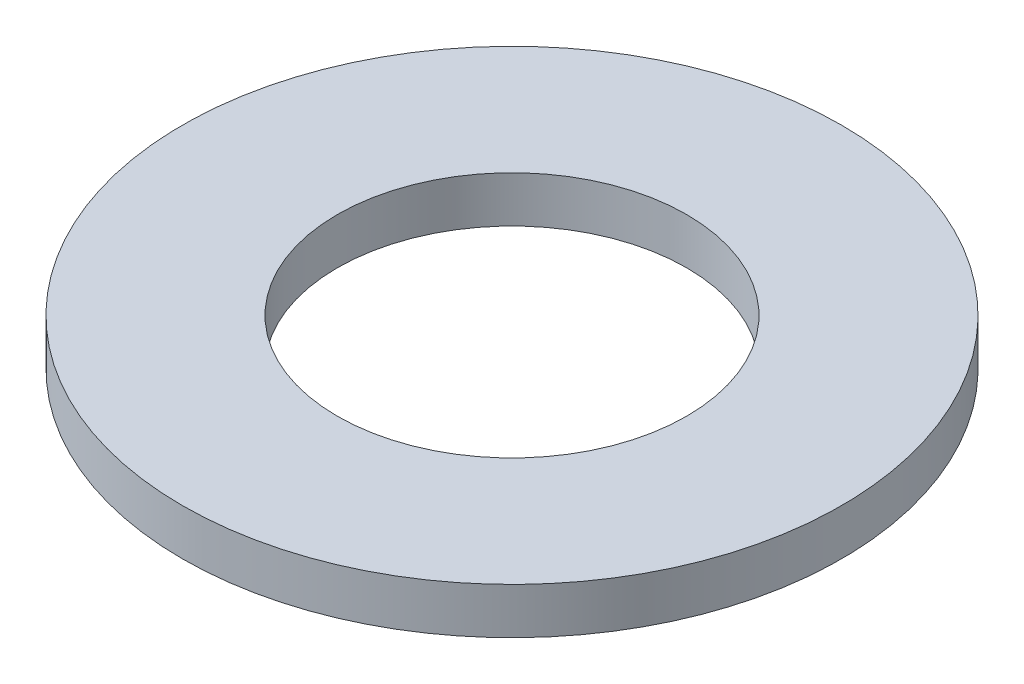
from build123d import *

# Parameters (mm, degrees)
SKETCH1_R           = 6.35
BOSS_EXTRUDE1_DEPTH = 0.889
SKETCH5_R           = 3.3655
CUT_EXTRUDE1_DEPTH  = 10.024152093


with BuildPart() as part:
    # Sketch1 → Boss-Extrude1 (new body)
    with BuildSketch(Plane(origin=(0, 0, 0), x_dir=(1, 0, 0), z_dir=(0, 1, 0))):
        with Locations(Location((0, 0, 0), (0, 0, 270))):
            Circle(SKETCH1_R)
    extrude(amount=BOSS_EXTRUDE1_DEPTH)

    # Sketch5 → Cut-Extrude1 (cut, through all)
    with BuildSketch(Plane(origin=(0, 0.889, 0), x_dir=(-1, 0, 0), z_dir=(0, 1, 0))):
        with Locations(Location((0, 0, 0), (0, 0, 90))):
            Circle(SKETCH5_R)
    extrude(amount=-CUT_EXTRUDE1_DEPTH, mode=Mode.SUBTRACT)


solid = part.part
